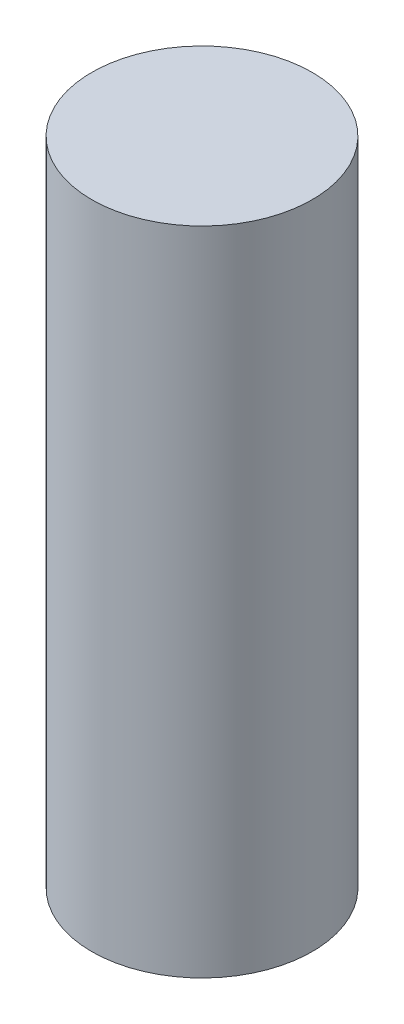
from build123d import *

# Parameters (mm, degrees)
BOSS_EXTRUDE1_DEPTH = 450
BOSS_EXTRUDE2_DEPTH = 450


with BuildPart() as part:
    # Sketch1 → Boss-Extrude1 (new body)
    with BuildSketch(Plane(origin=(0, 0, 0), x_dir=(1, 0, 0), z_dir=(0, 1, 0))):
        with BuildLine():
            ThreePointArc((23.8, -72.387844283), (76.2, 0), (23.8, 72.387844283))
            Line((23.8, 72.387844283), (23.8, -72.387844283))
        make_face()
    extrude(amount=BOSS_EXTRUDE1_DEPTH)

    # Sketch2 → Boss-Extrude2 (add)
    with BuildSketch(Plane(origin=(0, 0, 0), x_dir=(1, 0, 0), z_dir=(0, 1, 0))):
        with BuildLine():
            ThreePointArc((76.2, 0), (61.725197448, 44.681539812), (23.8, 72.387844283))
            Line((23.8, 72.387844283), (23.8, 0))
            Line((23.8, 0), (76.2, 0))
        make_face()
        with BuildLine():
            Line((23.8, 0), (23.8, 72.387844283))
            ThreePointArc((23.8, 72.387844283), (-44.681539812, 61.725197448), (-76.2, 0))
            Line((-76.2, 0), (23.8, 0))
        make_face()
        with BuildLine():
            Line((76.2, 0), (23.8, 0))
            Line((23.8, 0), (23.8, -72.387844283))
            ThreePointArc((23.8, -72.387844283), (61.725197448, -44.681539812), (76.2, 0))
        make_face()
        with BuildLine():
            Line((23.8, -72.387844283), (23.8, 0))
            Line((23.8, 0), (-76.2, 0))
            ThreePointArc((-76.2, 0), (-44.681539812, -61.725197448), (23.8, -72.387844283))
        make_face()
    extrude(amount=BOSS_EXTRUDE2_DEPTH)


solid = part.part
